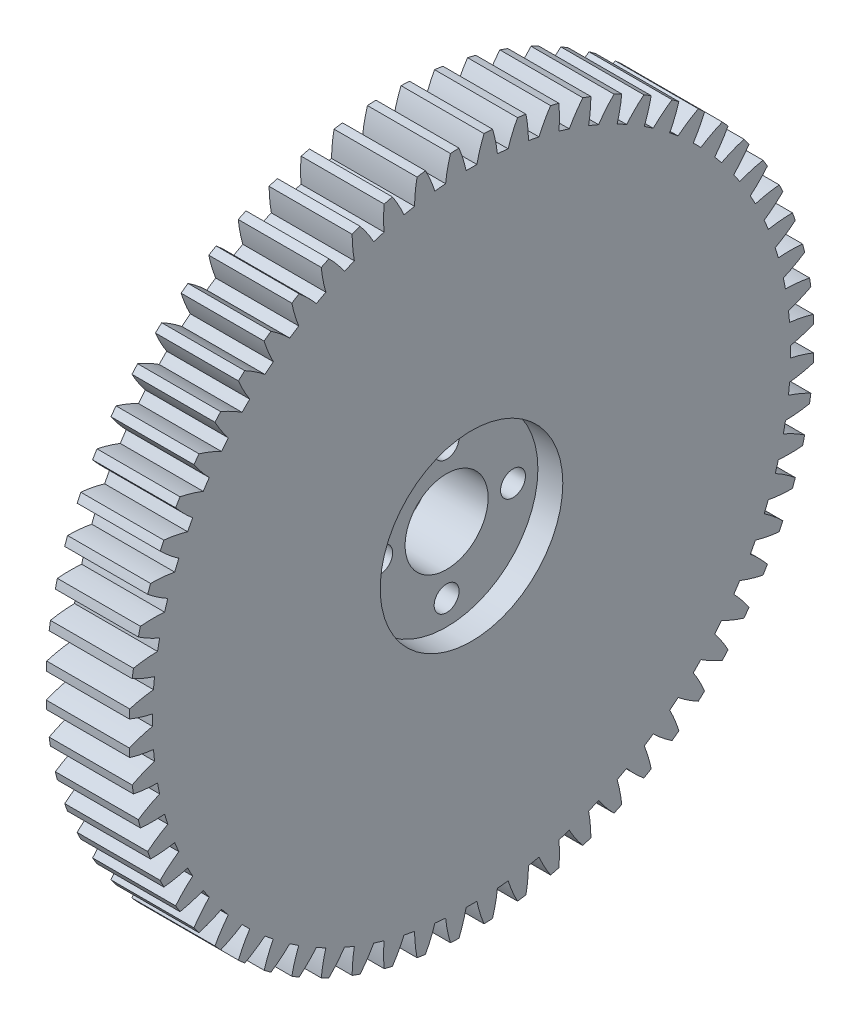
from build123d import *

# Parameters (mm, degrees)
BASPROSKE_W        = 10
BASPROSKE_H        = 41.25
TOOTHCUT_DEPTH     = 60.187203009
TEETHCUTS_COUNT    = 64
TEETHCUTS_ANGLE    = 354.375
BORSKE_R           = 3
BORE_DEPTH         = 50.0000508
SKETCH1_R          = 1.5
CUT_EXTRUDE1_DEPTH = 10
SKETCH2_R          = 11
CUT_EXTRUDE2_DEPTH = 3
CUT_EXTRUDE4_REACH = 60.716
SKETCH3_R          = 5
SKETCH4_R          = 2.25
CUT_EXTRUDE5_DEPTH = 2


with BuildPart() as part:
    # BasProSke → Base-Revolve (revolve)
    with BuildSketch(Plane(origin=(0, 0, 0), x_dir=(1, 0, 0), z_dir=(0, 1, 0)), mode=Mode.PRIVATE) as base_revolve_sk:
        with Locations((5, 20.625)):
            Rectangle(BASPROSKE_W, BASPROSKE_H)
    revolve(base_revolve_sk.sketch.rotate(Axis((-10, 0, 0), (1, 0, 0)), 180), axis=Axis((-10, 0, 0), (1, 0, 0)))

    # TooCutSke → ToothCut (cut, through all)
    with BuildSketch(Plane(origin=(0, 0, 0), x_dir=(0, 0, -1), z_dir=(1, 0, 0))):
        with BuildLine():
            ThreePointArc((0.649543456, 38.431011248), (0, 38.4365), (-0.649543456, 38.431011248))
            ThreePointArc((-0.649543456, 38.431011248), (-1.02060374, 39.859307188), (-1.521679885, 41.247340951))
            ThreePointArc((-1.521679885, 41.247340951), (0, 41.2754), (1.521679885, 41.247340951))
            ThreePointArc((1.521679885, 41.247340951), (1.02060374, 39.859307188), (0.649543456, 38.431011248))
        make_face()
    toothcut = extrude(amount=TOOTHCUT_DEPTH, mode=Mode.SUBTRACT)

    # TeethCuts: ToothCut ×64 about axis
    teethcuts_axis = Axis((-10, 0, 0), (1, 0, 0))
    for i in range(1, TEETHCUTS_COUNT):
        add(toothcut.rotate(teethcuts_axis, i * TEETHCUTS_ANGLE / (TEETHCUTS_COUNT - 1)), mode=Mode.SUBTRACT)

    # BorSke → Bore (cut, symmetric)
    with BuildSketch(Plane(origin=(0, 0, 0), x_dir=(0, 0, -1), z_dir=(1, 0, 0))):
        with Locations(Location((0, 0, 0), (0, 0, 180))):
            Circle(BORSKE_R)
    extrude(amount=BORE_DEPTH, both=True, mode=Mode.SUBTRACT)

    # Sketch1 → Cut-Extrude1 (cut)
    with BuildSketch(Plane(origin=(10, 0, 0), x_dir=(0, 0, -1), z_dir=(1, 0, 0))):
        with Locations((0, 8)):
            Circle(SKETCH1_R)
        with Locations((8, 0)):
            Circle(SKETCH1_R)
        with Locations((0, -8)):
            Circle(SKETCH1_R)
        with Locations((-8, 0)):
            Circle(SKETCH1_R)
    extrude(amount=-CUT_EXTRUDE1_DEPTH, mode=Mode.SUBTRACT)

    # Sketch2 → Cut-Extrude2 (cut)
    with BuildSketch(Plane(origin=(10, 0, 0), x_dir=(0, 0, -1), z_dir=(1, 0, 0))):
        Circle(SKETCH2_R)
    extrude(amount=-CUT_EXTRUDE2_DEPTH, mode=Mode.SUBTRACT)

    # Sketch3 → Cut-Extrude4 (cut, up to next)
    with BuildSketch(Plane(origin=(7, 0, 0), x_dir=(0, 0, -1), z_dir=(1, 0, 0)), mode=Mode.PRIVATE) as cut_extrude4_sk1:
        Circle(SKETCH3_R)
    cut_extrude4_tool1 = extrude(cut_extrude4_sk1.sketch, amount=-CUT_EXTRUDE4_REACH, mode=Mode.PRIVATE) & part.part
    add(cut_extrude4_tool1.solids().sort_by_distance((7, 0, 0))[0], mode=Mode.SUBTRACT)

    # Sketch4 → Cut-Extrude5 (cut)
    with BuildSketch(Plane.ZY):
        with Locations((0, 8)):
            Circle(SKETCH4_R)
        with Locations((8, 0)):
            Circle(SKETCH4_R)
        with Locations((0, -8)):
            Circle(SKETCH4_R)
        with Locations((-8, 0)):
            Circle(SKETCH4_R)
    extrude(amount=-CUT_EXTRUDE5_DEPTH, mode=Mode.SUBTRACT)


solid = part.part
